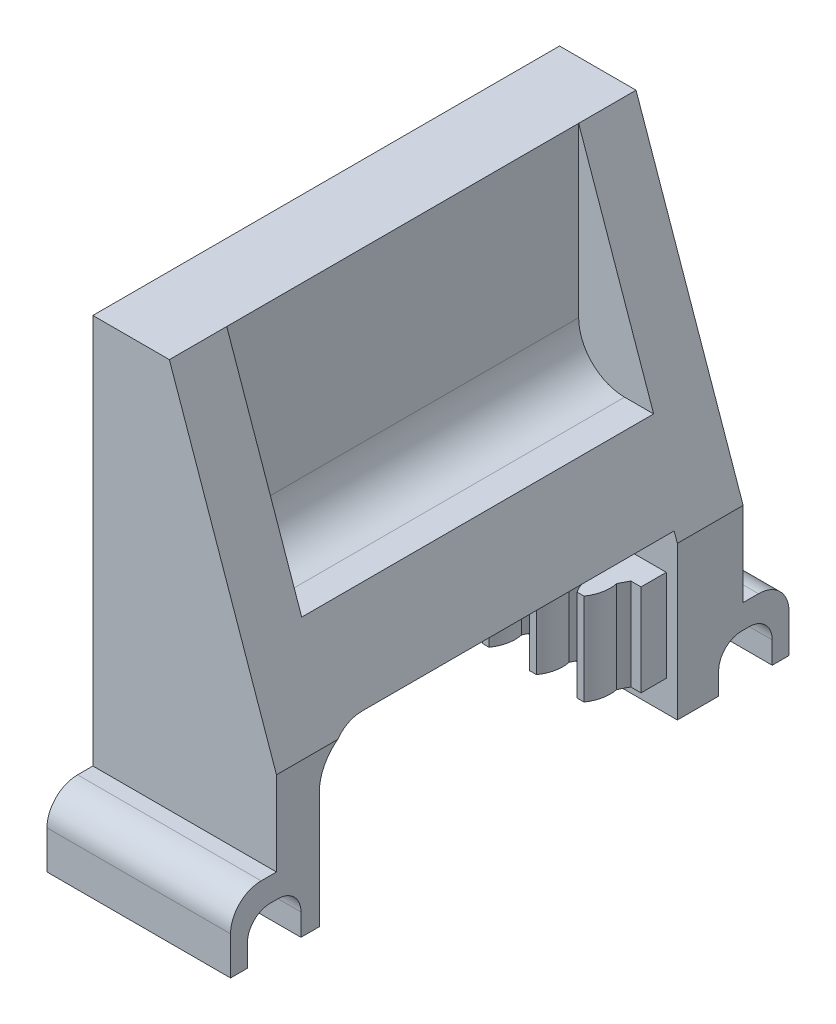
from build123d import *

# Parameters (mm, degrees)
BOSS_EXTRUDE1_DEPTH = 30.5
SKETCH4_W           = 23.4
SKETCH4_H           = 13
CUT_EXTRUDE2_DEPTH  = 25
CUT_EXTRUDE4_DEPTH  = 11.5
SKETCH7_W           = 31
SKETCH7_H           = 1.7
BOSS_EXTRUDE3_DEPTH = 6
BOSS_EXTRUDE4_DEPTH = 6
LPATTERN1_COUNT     = 10
LPATTERN1_PITCH     = 3.1
SKETCH11_W          = 12
SKETCH11_H          = 4.5
BOSS_EXTRUDE5_DEPTH = 3
FILLET1_R           = 2
FILLET2_R           = 2
FILLET5_R           = 3
SKETCH12_W          = 3.5
SKETCH12_H          = 3.5
CUT_EXTRUDE5_DEPTH  = 12
FILLET6_R           = 1.5


with BuildPart() as part:
    # Sketch1 → Boss-Extrude1 (new body)
    with BuildSketch(Plane.XY):
        Polygon((0, 0), (0, -30), (12, -30), (12, -20), (5, 0), align=None)
    extrude(amount=-BOSS_EXTRUDE1_DEPTH)

    # Sketch4 → Cut-Extrude2 (cut)
    with BuildSketch(Plane.ZY):
        with Locations((-14.5, -25.899949695)):
            Rectangle(SKETCH4_W, SKETCH4_H)
    extrude(amount=-CUT_EXTRUDE2_DEPTH, mode=Mode.SUBTRACT)

    # Sketch6 → Cut-Extrude4 (cut, symmetric)
    with BuildSketch(Plane.XY.offset(-15.25)):
        Polygon((5, 0), (5, -14), (9.9, -14), align=None)
    extrude(amount=CUT_EXTRUDE4_DEPTH, both=True, mode=Mode.SUBTRACT)

    # Sketch7 → Boss-Extrude3 (add)
    with BuildSketch(Plane(origin=(0, -28, 0), x_dir=(1, 0, 0), z_dir=(0, 1, 0))):
        with Locations((-4.2231607, 25.4)):
            Rectangle(SKETCH7_W, SKETCH7_H)
    extrude(amount=BOSS_EXTRUDE3_DEPTH)

    # Sketch10 → Boss-Extrude4 (add)
    with BuildSketch(Plane(origin=(0, -28, 0), x_dir=(1, 0, 0), z_dir=(0, 1, 0))):
        with BuildLine():
            Line((9.930277247, 22.163714857), (9.488014181, 22.163714857))
            ThreePointArc((9.488014181, 22.163714857), (9.122148109, 23.010204326), (9.120849309, 23.932376064))
            ThreePointArc((9.120849309, 23.932376064), (8.970587763, 24.244009331), (8.809145714, 24.55))
            Line((8.809145714, 24.55), (10.609145714, 24.55))
            ThreePointArc((10.609145714, 24.55), (10.447703664, 24.244009331), (10.297442118, 23.932376064))
            ThreePointArc((10.297442118, 23.932376064), (10.296143319, 23.010204326), (9.930277247, 22.163714857))
        make_face()
    boss_extrude4 = extrude(amount=BOSS_EXTRUDE4_DEPTH)

    # LPattern1: Boss-Extrude4 ×10
    with Locations(*[(-i * LPATTERN1_PITCH, 0, 0) for i in range(1, LPATTERN1_COUNT)]):
        add(boss_extrude4)

    # Sketch11 → Boss-Extrude5 (add)
    with BuildSketch(Plane(origin=(0, 0, -30.5), x_dir=(-1, 0, 0), z_dir=(0, 0, -1))):
        with Locations((-6, -27.75)):
            Rectangle(SKETCH11_W, SKETCH11_H)
    boss_extrude5 = extrude(amount=BOSS_EXTRUDE5_DEPTH)

    # Fillet1
    fillet1_edges = [part.edges().sort_by_distance(p)[0] for p in [
        (6, -25.5, -33.5),
    ]]
    fillet(fillet1_edges, radius=FILLET1_R)

    # Mirror1: Boss-Extrude5 across plane
    add(boss_extrude5.mirror(Plane.XY.offset(-15.25)))

    # Fillet2
    fillet2_edges = [part.edges().sort_by_distance(p)[0] for p in [
        (6, -25.5, 3),
    ]]
    fillet(fillet2_edges, radius=FILLET2_R)

    # Fillet5
    fillet5_edges = [part.edges().sort_by_distance(p)[0] for p in [
        (5, -14, -15.25),
        (5.894991197, -19.399949695, -2.8),
    ]]
    fillet(fillet5_edges, radius=FILLET5_R)

    # Sketch12 → Cut-Extrude5 (cut)
    with BuildSketch(Plane.ZY):
        with Locations((-30.65, -28.814354386)):
            Rectangle(SKETCH12_W, SKETCH12_H)
        with Locations((0.15, -28.814354386)):
            Rectangle(SKETCH12_W, SKETCH12_H)
    extrude(amount=-CUT_EXTRUDE5_DEPTH, mode=Mode.SUBTRACT)

    # Fillet6
    fillet6_edges = [part.edges().sort_by_distance(p)[0] for p in [
        (6, -27.064354386, -28.9),
        (6, -27.064354386, -32.4),
        (6, -27.064354386, -1.6),
        (6, -27.064354386, 1.9),
    ]]
    fillet(fillet6_edges, radius=FILLET6_R)


solid = part.part
